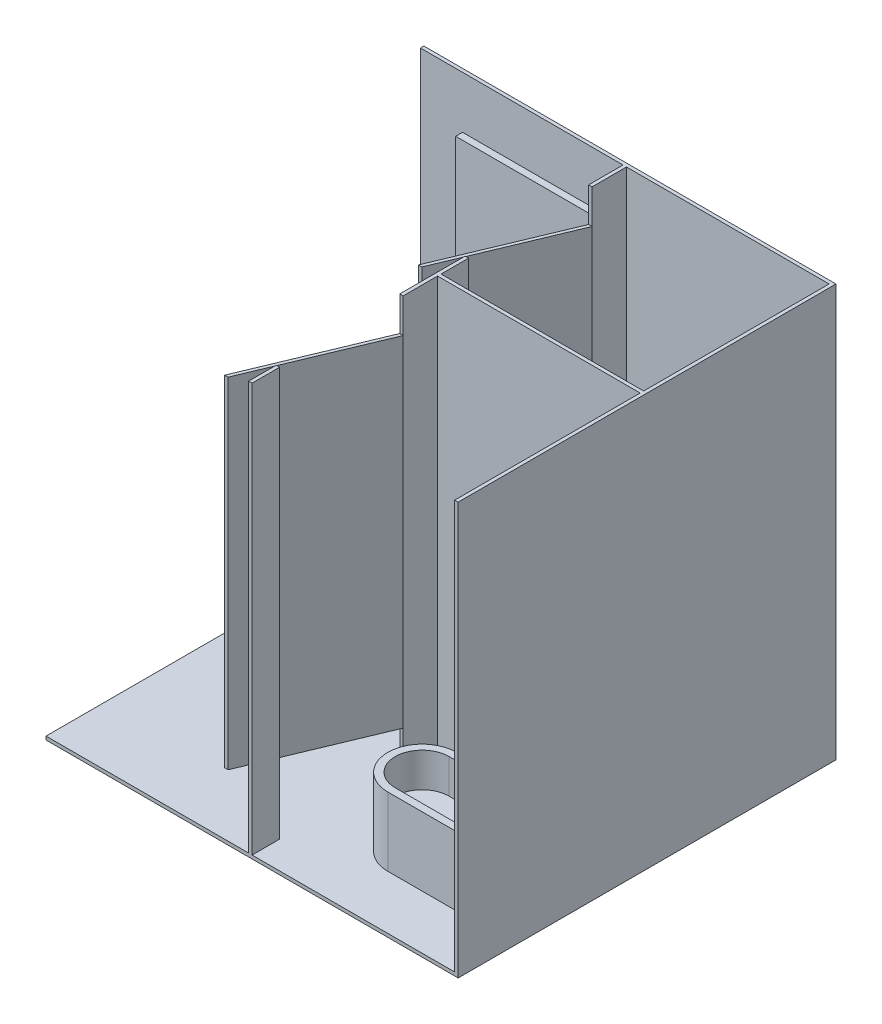
from build123d import *

# Parameters (mm, degrees)
SKETCH_1_W           = 120
SKETCH_1_H           = 110
EXTRUDE_2_DEPTH      = 120
SKETCH_2_W           = 118
SKETCH_2_H           = 118
CUT_EXTRUDE_1_DEPTH  = 109
SKETCH_5_W           = 109
SKETCH_5_H           = 118
CUT_EXTRUDE_2_DEPTH  = 109
SKETCH_6_W           = 119
SKETCH_6_H           = 109
CUT_EXTRUDE_3_DEPTH  = 109
SKETCH_7_W           = 1
SKETCH_7_H           = 109
EXTRUDE_3_DEPTH      = 119
SKETCH_8_W           = 119
SKETCH_8_H           = 1
EXTRUDE_5_DEPTH      = 119
SKETCH_9_W           = 36
SKETCH_9_H           = 10
CUT_EXTRUDE_4_DEPTH  = 39
SKETCH_11_W          = 36
SKETCH_11_H          = 10
CUT_EXTRUDE_5_DEPTH  = 39
SKETCH_12_W          = 36
SKETCH_12_H          = 99
EXTRUDE_6_DEPTH      = 30
CUT_EXTRUDE_6_DEPTH  = 100
SKETCH_14_W          = 36
SKETCH_14_H          = 99
EXTRUDE_7_DEPTH      = 30
CUT_EXTRUDE_7_DEPTH  = 100
EXTRUDE_9_DEPTH      = 20
CUT_EXTRUDE_8_DEPTH  = 10
CUT_EXTRUDE_9_DEPTH  = 10
SKETCH_22_W          = 0.925592825
SKETCH_22_H          = 19.270027161
EXTRUDE_10_DEPTH     = 30
CUT_EXTRUDE_14_DEPTH = 5
SKETCH_27_R          = 8
EXTRUDE_14_DEPTH     = 40
SKETCH_29_R          = 5.381413495
CUT_EXTRUDE_15_DEPTH = 5
SKETCH_30_R          = 1.016249725
EXTRUDE_15_DEPTH     = 10
EXTRUDE_16_DEPTH     = 3
SKETCH_32_W          = 44.189123475
SKETCH_32_H          = 49.118532685
EXTRUDE_17_DEPTH     = 2
SKETCH_33_W          = 59
SKETCH_33_H          = 119
CUT_EXTRUDE_16_DEPTH = 10


with BuildPart() as part:
    # 스케치1 → 보스-돌출2 (new body)
    with BuildSketch(Plane(origin=(0, 0, 0), x_dir=(1, 0, 0), z_dir=(0, 1, 0))):
        Rectangle(SKETCH_1_W, SKETCH_1_H)
    extrude(amount=EXTRUDE_2_DEPTH)

    # 스케치2 → 컷-돌출1 (cut)
    with BuildSketch(Plane.XY.offset(55)):
        with Locations((0, 60)):
            Rectangle(SKETCH_2_W, SKETCH_2_H)
    extrude(amount=-CUT_EXTRUDE_1_DEPTH, mode=Mode.SUBTRACT)

    # 스케치5 → 컷-돌출2 (cut)
    with BuildSketch(Plane.ZY.offset(60)):
        with Locations((0.5, 60)):
            Rectangle(SKETCH_5_W, SKETCH_5_H)
    extrude(amount=-CUT_EXTRUDE_2_DEPTH, mode=Mode.SUBTRACT)

    # 스케치6 → 컷-돌출3 (cut)
    with BuildSketch(Plane(origin=(0, 120, 0), x_dir=(1, 0, 0), z_dir=(0, 1, 0))):
        with Locations((-0.5, -0.5)):
            Rectangle(SKETCH_6_W, SKETCH_6_H)
    extrude(amount=-CUT_EXTRUDE_3_DEPTH, mode=Mode.SUBTRACT)

    # 스케치7 → 보스-돌출3 (add)
    with BuildSketch(Plane(origin=(0, 1, 0), x_dir=(1, 0, 0), z_dir=(0, 1, 0))):
        with Locations((-0.5, -0.5)):
            Rectangle(SKETCH_7_W, SKETCH_7_H)
    extrude(amount=EXTRUDE_3_DEPTH)

    # 스케치8 → 보스-돌출5 (add)
    with BuildSketch(Plane(origin=(0, 1, 0), x_dir=(1, 0, 0), z_dir=(0, 1, 0))):
        with Locations((-0.5, -0.5)):
            Rectangle(SKETCH_8_W, SKETCH_8_H)
    extrude(amount=EXTRUDE_5_DEPTH)

    # 스케치9 → 컷-돌출4 (cut)
    with BuildSketch(Plane.ZY.offset(1)):
        with Locations((-26, 115)):
            Rectangle(SKETCH_9_W, SKETCH_9_H)
        with Locations((-26, 6)):
            Rectangle(SKETCH_9_W, SKETCH_9_H)
    extrude(amount=-CUT_EXTRUDE_4_DEPTH, mode=Mode.SUBTRACT)

    # 스케치11 → 컷-돌출5 (cut)
    with BuildSketch(Plane.ZY.offset(1)):
        with Locations((29, 115)):
            Rectangle(SKETCH_11_W, SKETCH_11_H)
        with Locations((29, 6)):
            Rectangle(SKETCH_11_W, SKETCH_11_H)
    extrude(amount=-CUT_EXTRUDE_5_DEPTH, mode=Mode.SUBTRACT)

    # 스케치12 → 보스-돌출6 (add)
    with BuildSketch(Plane.ZY.offset(1)):
        with Locations((-26, 60.5)):
            Rectangle(SKETCH_12_W, SKETCH_12_H)
    extrude(amount=EXTRUDE_6_DEPTH)

    # 스케치13 → 컷-돌출6 (cut)
    with BuildSketch(Plane(origin=(0, 110, 0), x_dir=(1, 0, 0), z_dir=(0, 1, 0))):
        Polygon((-1, 44), (-16, 8), (-31, 8), (-31, 44), align=None)
        Polygon((0, 44), (-15, 8), (0, 8), align=None)
    extrude(amount=-CUT_EXTRUDE_6_DEPTH, mode=Mode.SUBTRACT)

    # 스케치14 → 보스-돌출7 (add)
    with BuildSketch(Plane.ZY.offset(1)):
        with Locations((29, 60.5)):
            Rectangle(SKETCH_14_W, SKETCH_14_H)
    extrude(amount=EXTRUDE_7_DEPTH)

    # 스케치15 → 컷-돌출7 (cut)
    with BuildSketch(Plane(origin=(0, 110, 0), x_dir=(1, 0, 0), z_dir=(0, 1, 0))):
        Polygon((-1, -11), (-16, -47), (-31, -47), (-31, -11), align=None)
        Polygon((0, -11), (-15, -47), (0, -47), align=None)
    extrude(amount=-CUT_EXTRUDE_7_DEPTH, mode=Mode.SUBTRACT)

    # 스케치16 → 보스-돌출9 (add)
    with BuildSketch(Plane(origin=(0, 1, 0), x_dir=(1, 0, 0), z_dir=(0, 1, 0))):
        with BuildLine():
            Line((48.146914235, -39.33942453), (23.856416777, -39.33942453))
            ThreePointArc((23.856416777, -39.33942453), (13.856416777, -29.33942453), (23.856416777, -19.33942453))
            Line((23.856416777, -19.33942453), (48.146914235, -19.33942453))
            ThreePointArc((48.146914235, -19.33942453), (58.146914235, -29.33942453), (48.146914235, -39.33942453))
        make_face()
        with BuildLine():
            Line((48.146914235, 38.33942453), (23.856416777, 38.33942453))
            ThreePointArc((23.856416777, 38.33942453), (13.856416777, 28.33942453), (23.856416777, 18.33942453))
            Line((23.856416777, 18.33942453), (48.146914235, 18.33942453))
            ThreePointArc((48.146914235, 18.33942453), (58.146914235, 28.33942453), (48.146914235, 38.33942453))
        make_face()
    extrude(amount=EXTRUDE_9_DEPTH)

    # 스케치17 → 컷-돌출8 (cut)
    with BuildSketch(Plane(origin=(0, 21, 0), x_dir=(1, 0, 0), z_dir=(0, 1, 0))):
        with BuildLine():
            Line((23.856416777, -21.474798149), (42.567688879, -21.474798149))
            ThreePointArc((42.567688879, -21.474798149), (50.43231526, -29.33942453), (42.567688879, -37.204050911))
            Line((42.567688879, -37.204050911), (23.856416777, -37.204050911))
            ThreePointArc((23.856416777, -37.204050911), (15.991790397, -29.33942453), (23.856416777, -21.474798149))
        make_face()
        with BuildLine():
            Line((23.856416777, 20.474798149), (42.567688879, 20.474798149))
            ThreePointArc((42.567688879, 20.474798149), (50.43231526, 28.33942453), (42.567688879, 36.204050911))
            Line((42.567688879, 36.204050911), (23.856416777, 36.204050911))
            ThreePointArc((23.856416777, 36.204050911), (15.991790397, 28.33942453), (23.856416777, 20.474798149))
        make_face()
    extrude(amount=-CUT_EXTRUDE_8_DEPTH, mode=Mode.SUBTRACT)

    # 스케치19 → 컷-돌출9 (cut)
    with BuildSketch(Plane(origin=(0, 11, 0), x_dir=(1, 0, 0), z_dir=(0, 1, 0))):
        with BuildLine():
            Line((39.6013509, 31.146236018), (44.272476327, 31.146236018))
            ThreePointArc((44.272476327, 31.146236018), (46.906569613, 28.512142732), (44.272476327, 25.878049447))
            Line((44.272476327, 25.878049447), (39.6013509, 25.878049447))
            ThreePointArc((39.6013509, 25.878049447), (36.967257615, 28.512142732), (39.6013509, 31.146236018))
        make_face()
        with BuildLine():
            Line((39.6013509, -32.146236018), (44.272476327, -32.146236018))
            ThreePointArc((44.272476327, -32.146236018), (46.906569613, -29.512142732), (44.272476327, -26.878049447))
            Line((44.272476327, -26.878049447), (39.6013509, -26.878049447))
            ThreePointArc((39.6013509, -26.878049447), (36.967257615, -29.512142732), (39.6013509, -32.146236018))
        make_face()
    extrude(amount=-CUT_EXTRUDE_9_DEPTH, mode=Mode.SUBTRACT)

    # 스케치22 → 보스-돌출10 (add)
    with BuildSketch(Plane(origin=(0, 21, 0), x_dir=(1, 0, 0), z_dir=(0, 1, 0))):
        with Locations((51.210576598, -29.360263905)):
            Rectangle(SKETCH_22_W, SKETCH_22_H)
        with Locations((51.210576598, 28.360263905)):
            Rectangle(SKETCH_22_W, SKETCH_22_H)
    extrude(amount=EXTRUDE_10_DEPTH)

    # 스케치26 → 컷-돌출14 (cut)
    with BuildSketch(Plane.ZY.offset(-50.747780185)):
        with BuildLine():
            Line((19.725250325, 51), (19.725250325, 42.862531911))
            ThreePointArc((19.725250325, 42.862531911), (29.360263905, 50.947462847), (38.995277486, 42.862531911))
            Line((38.995277486, 42.862531911), (38.995277486, 51))
            Line((38.995277486, 51), (19.725250325, 51))
        make_face()
        with BuildLine():
            Line((-38.143872213, 41.16385454), (-38.143872213, 57.416257422))
            Line((-38.143872213, 57.416257422), (-18.576655598, 57.416257422))
            Line((-18.576655598, 57.416257422), (-18.576655598, 41.16385454))
            ThreePointArc((-18.576655598, 41.16385454), (-28.360263905, 50.947462847), (-38.143872213, 41.16385454))
        make_face()
    extrude(amount=-CUT_EXTRUDE_14_DEPTH, mode=Mode.SUBTRACT)

    # 스케치27 → 보스-돌출14 (add)
    with BuildSketch(Plane(origin=(0, 1, 0), x_dir=(1, 0, 0), z_dir=(0, 1, 0))):
        with Locations(Location((-30.5, 44, 0), (0, 0, 90))):
            Circle(SKETCH_27_R)
    extrude(amount=EXTRUDE_14_DEPTH)

    # 스케치29 → 컷-돌출15 (cut)
    with BuildSketch(Plane(origin=(0, 41, 0), x_dir=(1, 0, 0), z_dir=(0, 1, 0))):
        with Locations(Location((-30.5, 42.18650453, 0), (0, 0, 270))):
            Circle(SKETCH_29_R)
    extrude(amount=-CUT_EXTRUDE_15_DEPTH, mode=Mode.SUBTRACT)

    # 스케치30 → 보스-돌출15 (add)
    with BuildSketch(Plane(origin=(0, 41, 0), x_dir=(1, 0, 0), z_dir=(0, 1, 0))):
        with Locations(Location((-30.5, 49.674732838, 0), (0, 0, 270))):
            Circle(SKETCH_30_R)
    extrude(amount=EXTRUDE_15_DEPTH)

    # 스케치31 → 보스-돌출16 (add)
    with BuildSketch(Plane(origin=(0, 51, 0), x_dir=(1, 0, 0), z_dir=(0, 1, 0))):
        with BuildLine():
            Line((-29.503658446, 49.674732838), (-29.503658446, 46.055904325))
            ThreePointArc((-29.503658446, 46.055904325), (-30.5, 45.059562771), (-31.496341554, 46.055904325))
            Line((-31.496341554, 46.055904325), (-31.496341554, 49.674732838))
            ThreePointArc((-31.496341554, 49.674732838), (-30.5, 50.671074391), (-29.503658446, 49.674732838))
        make_face()
    extrude(amount=EXTRUDE_16_DEPTH)

    # 스케치32 → 보스-돌출17 (add)
    with BuildSketch(Plane.XY.offset(-54)):
        with Locations((-25.626680732, 80.311397781)):
            Rectangle(SKETCH_32_W, SKETCH_32_H)
    extrude(amount=EXTRUDE_17_DEPTH)

    # 스케치33 → 컷-돌출16 (cut)
    with BuildSketch(Plane.XY.offset(1)):
        with Locations((-30.5, 60.5)):
            Rectangle(SKETCH_33_W, SKETCH_33_H)
    extrude(amount=-CUT_EXTRUDE_16_DEPTH, mode=Mode.SUBTRACT)


solid = part.part
